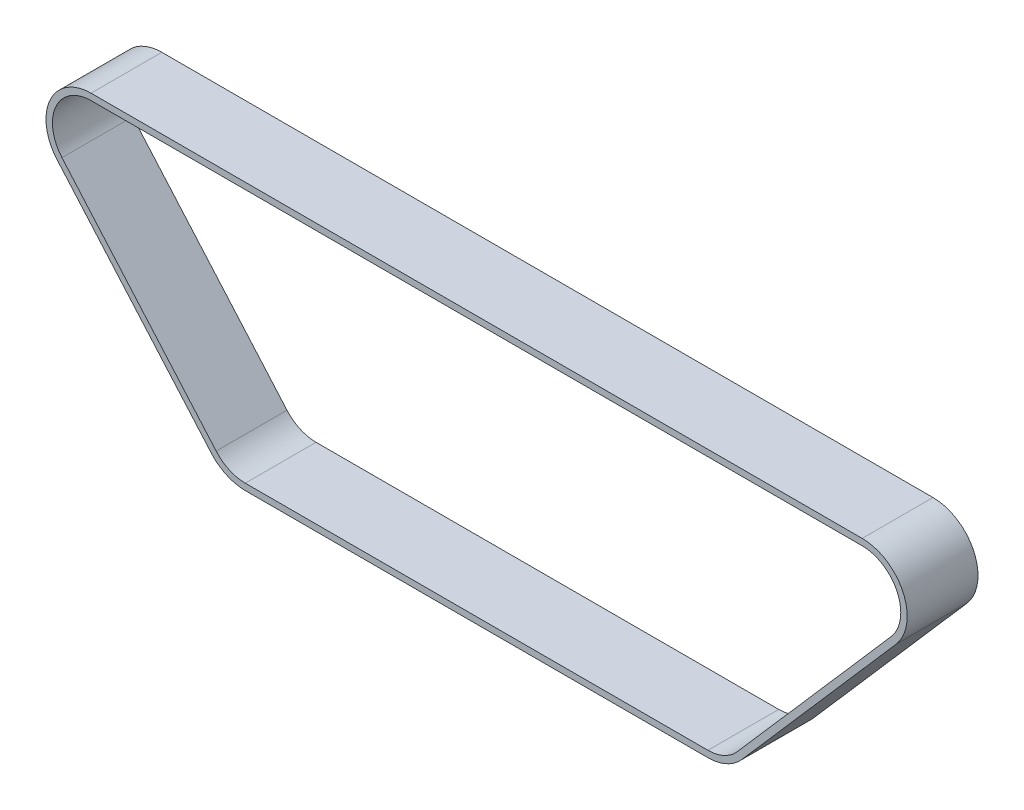
from build123d import *

# Parameters (mm, degrees)
EXTRUDE_1_DEPTH = 44


with BuildPart() as part:
    # 草图1 → 凸台-拉伸1 (new body)
    with BuildSketch(Plane.XY):
        with BuildLine():
            Line((-89.644660941, 153), (389.644660941, 153))
            ThreePointArc((389.644660941, 153), (415.13066863, 136.59583598), (410.754058437, 106.604529434))
            Line((410.754058437, 106.604529434), (314.896194061, -3.395470566))
            ThreePointArc((314.896194061, -3.395470566), (305.382632544, -10.486007689), (293.786796564, -13))
            Line((293.786796564, -13), (6.213203436, -13))
            ThreePointArc((6.213203436, -13), (-5.382632544, -10.486007689), (-14.896194061, -3.395470566))
            Line((-14.896194061, -3.395470566), (-110.754058437, 106.604529434))
            ThreePointArc((-110.754058437, 106.604529434), (-115.13066863, 136.59583598), (-89.644660941, 153))
        make_face()
        with BuildLine():
            Line((-89.644660941, 149), (389.644660941, 149))
            ThreePointArc((389.644660941, 149), (411.489810388, 134.939287983), (407.738430223, 109.232453801))
            Line((407.738430223, 109.232453801), (311.880565847, -0.767546199))
            ThreePointArc((311.880565847, -0.767546199), (303.726084547, -6.845149448), (293.786796564, -9))
            Line((293.786796564, -9), (6.213203436, -9))
            ThreePointArc((6.213203436, -9), (-3.726084547, -6.845149448), (-11.880565847, -0.767546199))
            Line((-11.880565847, -0.767546199), (-107.738430223, 109.232453801))
            ThreePointArc((-107.738430223, 109.232453801), (-111.489810388, 134.939287983), (-89.644660941, 149))
        make_face(mode=Mode.SUBTRACT)
    extrude(amount=EXTRUDE_1_DEPTH)


solid = part.part
